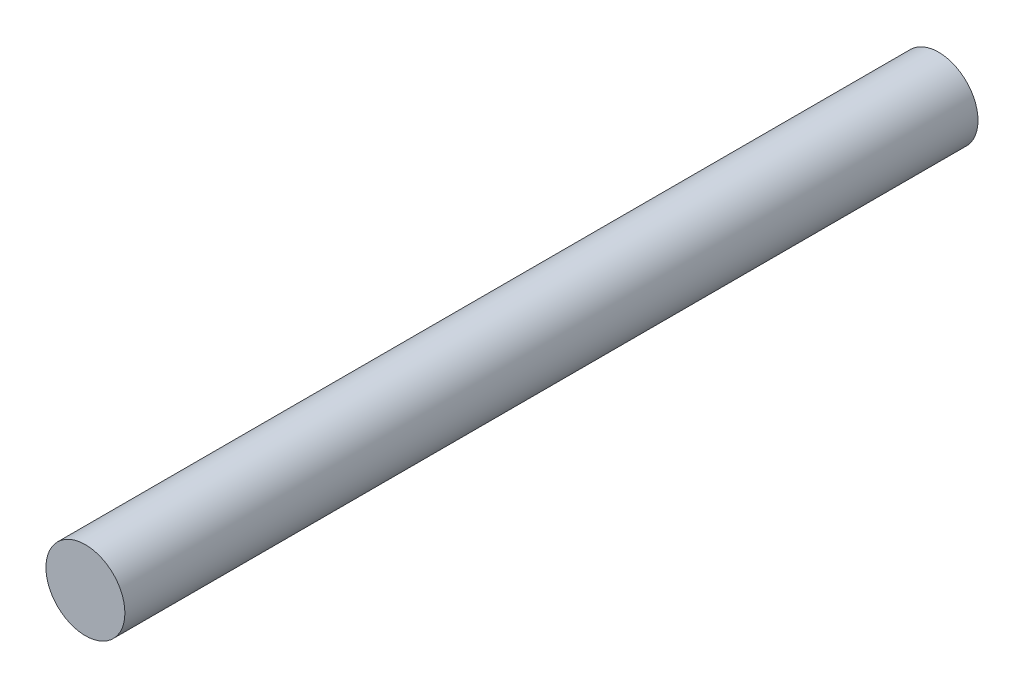
from build123d import *

# Parameters (mm, degrees)
SKETCH_1_R      = 0.995
EXTRUDE_1_DEPTH = 21.5


with BuildPart() as part:
    # 스케치1 → 보스-돌출1 (new body)
    with BuildSketch(Plane.XY):
        Circle(SKETCH_1_R)
    extrude(amount=EXTRUDE_1_DEPTH)


solid = part.part
